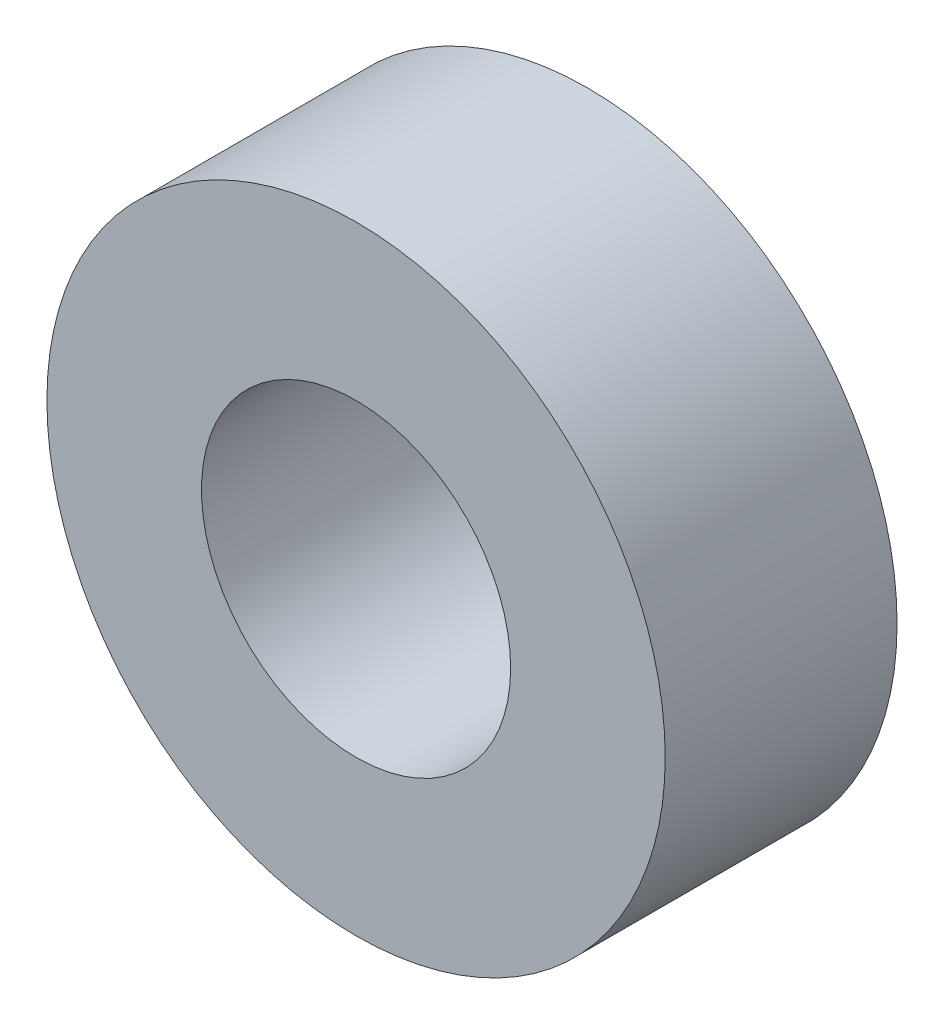
from build123d import *

# Parameters (mm, degrees)
SCHIZZO1_R                   = 4
SCHIZZO1_R_2                 = 2
ESTRUSIONE_ESTRUSIONE1_DEPTH = 3


with BuildPart() as part:
    # Schizzo1 → Estrusione-Estrusione1 (new body)
    with BuildSketch(Plane.XY):
        Circle(SCHIZZO1_R)
        Circle(SCHIZZO1_R_2, mode=Mode.SUBTRACT)
    extrude(amount=ESTRUSIONE_ESTRUSIONE1_DEPTH)


solid = part.part
